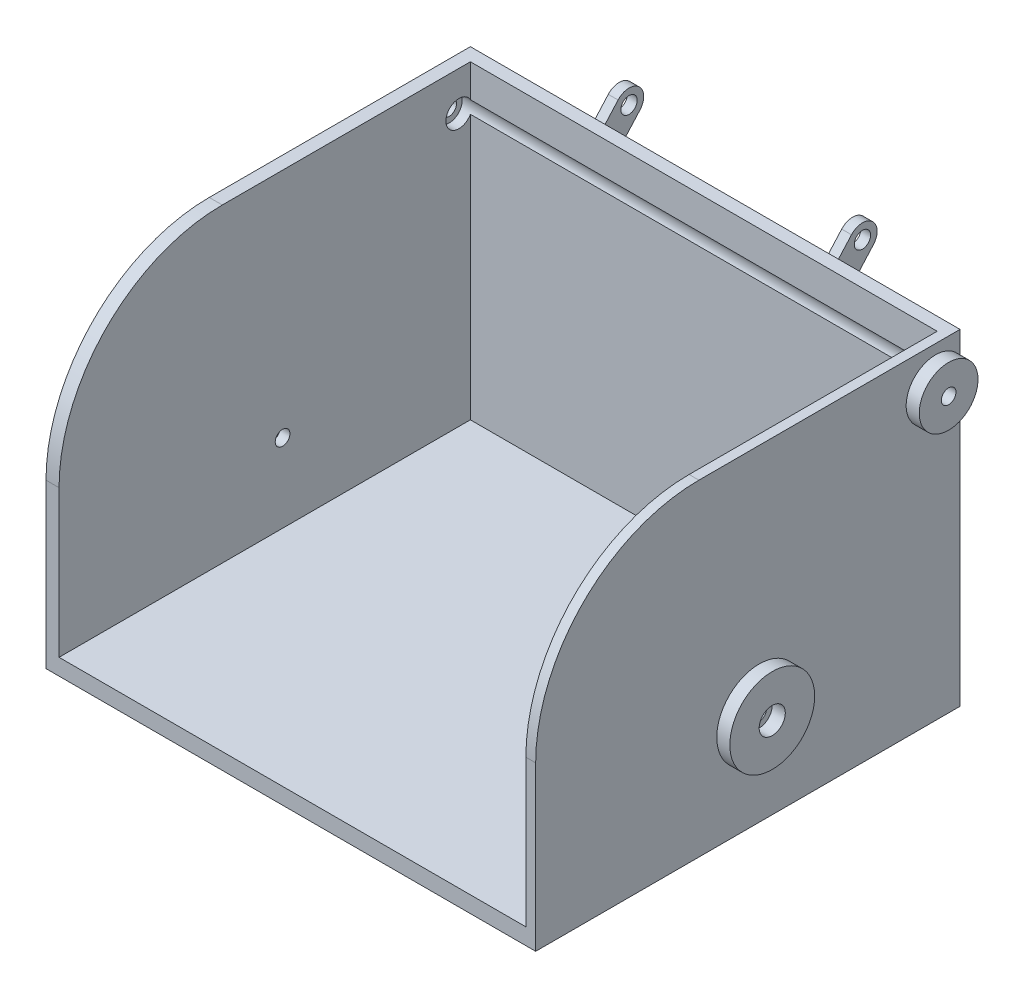
from build123d import *

# Parameters (mm, degrees)
BOSS_EXTRUDE1_DEPTH = 150
SKETCH2_W           = 143
SKETCH2_H           = 131
CUT_EXTRUDE1_DEPTH  = 95
SKETCH3_R           = 2.5
BOSS_EXTRUDE2_DEPTH = 1.5
CUT_EXTRUDE2_REACH  = 227.015
SKETCH4_R           = 2.25
SKETCH4_R_2         = 4
SKETCH5_R           = 9
SKETCH5_R_2         = 2.25
SKETCH5_R_3         = 13
SKETCH5_R_4         = 4
BOSS_EXTRUDE3_DEPTH = 4


with BuildPart() as part:
    # Sketch1 → Boss-Extrude1 (new body)
    with BuildSketch(Plane(origin=(0, 0, 0), x_dir=(0, 0, -1), z_dir=(1, 0, 0))):
        with BuildLine():
            Line((0, 0), (-130, 0))
            Line((-130, 0), (-130, 50))
            ThreePointArc((-130, 50), (-115.355339059, 85.355339059), (-80, 100))
            Line((-80, 100), (0, 100))
            Line((0, 100), (0, 0))
        make_face()
    extrude(amount=BOSS_EXTRUDE1_DEPTH)

    # Sketch2 → Cut-Extrude1 (cut)
    with BuildSketch(Plane(origin=(0, 100, 0), x_dir=(1, 0, 0), z_dir=(0, 1, 0))):
        with Locations((75.5, -69.5)):
            Rectangle(SKETCH2_W, SKETCH2_H)
    extrude(amount=-CUT_EXTRUDE1_DEPTH, mode=Mode.SUBTRACT)

    # Sketch3 → Boss-Extrude2 (add, symmetric)
    with BuildSketch(Plane(origin=(111.25, 0, 0), x_dir=(0, 0, -1), z_dir=(1, 0, 0))):
        with BuildLine():
            Line((0, 100), (0, 86.483689179))
            Line((0, 86.483689179), (10.709846007, 98.483689179))
            ThreePointArc((10.709846007, 98.483689179), (10.348889249, 104.837405432), (3.995172996, 104.476448674))
            Line((3.995172996, 104.476448674), (0, 100))
        make_face()
        with Locations((7.352509502, 101.480068927)):
            Circle(SKETCH3_R, mode=Mode.SUBTRACT)
    boss_extrude2 = extrude(amount=BOSS_EXTRUDE2_DEPTH, both=True)

    # Mirror1: Boss-Extrude2 across plane
    add(boss_extrude2.mirror(Plane(origin=(75.5, 0, 0), x_dir=(0, 0, 1), z_dir=(1, 0, 0))))

    # Sketch4 → Cut-Extrude2 (cut, up to next)
    with BuildSketch(Plane(origin=(150, 0, 0), x_dir=(0, 0, -1), z_dir=(1, 0, 0)), mode=Mode.PRIVATE) as cut_extrude2_sk1:
        with Locations((-61.531516432, 29)):
            Circle(SKETCH4_R)
    cut_extrude2_tool1 = extrude(cut_extrude2_sk1.sketch, amount=-CUT_EXTRUDE2_REACH, mode=Mode.PRIVATE) & part.part
    # Sketch4 → Cut-Extrude2 (cut, up to next)
    with BuildSketch(Plane(origin=(150, 0, 0), x_dir=(0, 0, -1), z_dir=(1, 0, 0)), mode=Mode.PRIVATE) as cut_extrude2_sk2:
        with Locations((-7.503745795, 88)):
            Circle(SKETCH4_R_2)
    cut_extrude2_tool2 = extrude(cut_extrude2_sk2.sketch, amount=-CUT_EXTRUDE2_REACH, mode=Mode.PRIVATE) & part.part
    cut_extrude2_1 = cut_extrude2_tool1.solids().sort_by_distance((150, 29, 61.531516))[0]
    add(cut_extrude2_1, mode=Mode.SUBTRACT)
    cut_extrude2_2 = cut_extrude2_tool2.solids().sort_by_distance((150, 88, 7.503746))[0]
    add(cut_extrude2_2, mode=Mode.SUBTRACT)
    cut_extrude2 = cut_extrude2_1 + cut_extrude2_2  # Cut-Extrude2 as one shape, for the pattern or mirror that repeats it

    # Mirror2: Cut-Extrude2 across plane
    add(cut_extrude2.mirror(Plane(origin=(75.5, 0, 0), x_dir=(0, 0, 1), z_dir=(1, 0, 0))), mode=Mode.SUBTRACT)

    # Sketch5 → Boss-Extrude3 (add)
    # profile 1 of 2: a face of its own
    with BuildSketch(Plane(origin=(150, 0, 0), x_dir=(0, 0, -1), z_dir=(1, 0, 0))):
        with Locations(Location((-7.5, 88, 0), (0, 0, 326.442690238))):
            Circle(SKETCH5_R)
        with Locations((-7.5, 88)):
            Circle(SKETCH5_R_2, mode=Mode.SUBTRACT)
    # profile 2 of 2: a face of its own
    with BuildSketch(Plane(origin=(150, 0, 0), x_dir=(0, 0, -1), z_dir=(1, 0, 0))):
        with Locations((-61.53, 29)):
            Circle(SKETCH5_R_3)
        with Locations((-61.53, 29)):
            Circle(SKETCH5_R_4, mode=Mode.SUBTRACT)
    boss_extrude3 = extrude(amount=BOSS_EXTRUDE3_DEPTH)

    # Mirror3: Boss-Extrude3 across plane
    add(boss_extrude3.mirror(Plane(origin=(75.5, 0, 0), x_dir=(0, 0, 1), z_dir=(1, 0, 0))))


solid = part.part
